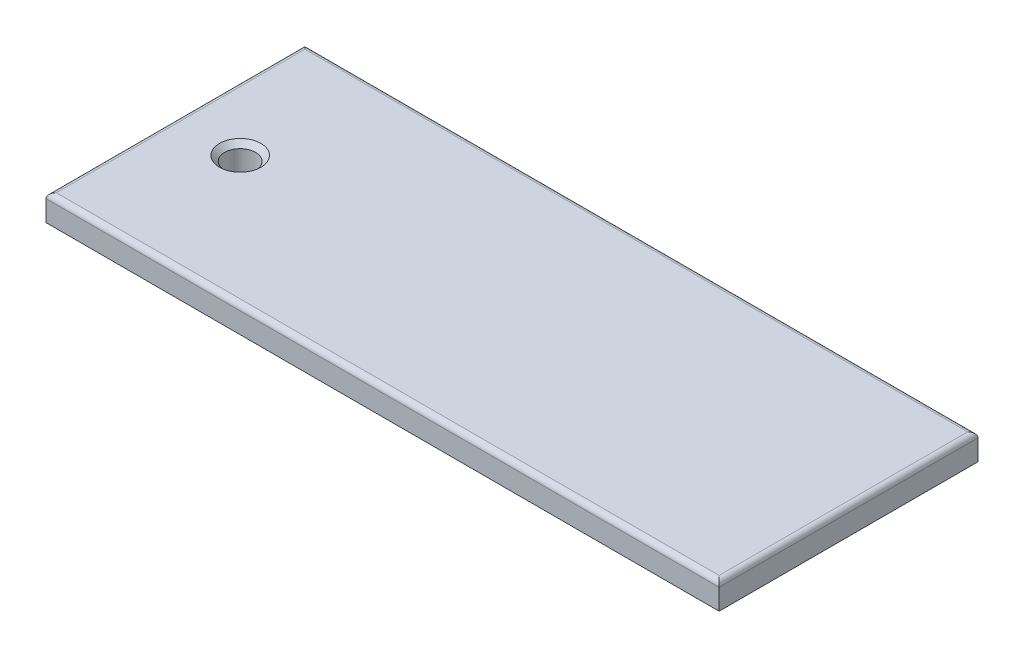
from build123d import *

# Parameters (mm, degrees)
SKETCH1_W           = 260
SKETCH1_H           = 100
BOSS_EXTRUDE1_DEPTH = 10
FILLET1_R           = 2
SKETCH2_R           = 6
CUT_EXTRUDE1_DEPTH  = 140.642400438
CHAMFER1_SIZE       = 2


with BuildPart() as part:
    # Sketch1 → Boss-Extrude1 (new body)
    with BuildSketch(Plane(origin=(0, 0, 0), x_dir=(1, 0, 0), z_dir=(0, 1, 0))):
        Rectangle(SKETCH1_W, SKETCH1_H)
    extrude(amount=BOSS_EXTRUDE1_DEPTH)

    # Fillet1
    fillet1_edges = [part.edges().sort_by_distance(p)[0] for p in [
        (130, 10, 0),
        (0, 10, -50),
        (-130, 10, 0),
        (0, 10, 50),
    ]]
    fillet(fillet1_edges, radius=FILLET1_R)

    # Sketch2 → Cut-Extrude1 (cut, through all)
    with BuildSketch(Plane(origin=(0, 10, 0), x_dir=(1, 0, 0), z_dir=(0, 1, 0))):
        with Locations(Location((-105, 0, 0), (0, 0, 270))):
            Circle(SKETCH2_R)
    extrude(amount=-CUT_EXTRUDE1_DEPTH, mode=Mode.SUBTRACT)

    # Chamfer1
    chamfer1_edges = [part.edges().sort_by_distance(p)[0] for p in [
        (-105, 10, -6),
    ]]
    chamfer(chamfer1_edges, length=CHAMFER1_SIZE)


solid = part.part
